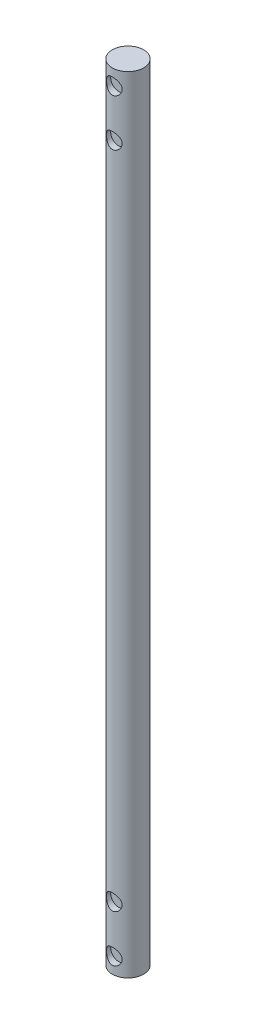
from build123d import *

# Parameters (mm, degrees)
SKETCH1_R           = 5
BOSS_EXTRUDE1_DEPTH = 250
CUT_EXTRUDE1_START  = 5
SKETCH5_R           = 2.5
CUT_EXTRUDE1_DEPTH  = 2


with BuildPart() as part:
    # Sketch1 → Boss-Extrude1 (new body)
    with BuildSketch(Plane(origin=(0, 0, 0), x_dir=(1, 0, 0), z_dir=(0, 1, 0))):
        with Locations(Location((0, 0, 0), (0, 0, 270))):
            Circle(SKETCH1_R)
    extrude(amount=BOSS_EXTRUDE1_DEPTH)

    # Sketch5 → Cut-Extrude1 (cut)
    with BuildSketch(Plane.XY.offset(CUT_EXTRUDE1_START)):
        with Locations((0, 5)):
            Circle(SKETCH5_R)
        with Locations((0, 20)):
            Circle(SKETCH5_R)
        with Locations((0, 245)):
            Circle(SKETCH5_R)
        with Locations((0, 230)):
            Circle(SKETCH5_R)
    extrude(amount=-CUT_EXTRUDE1_DEPTH, mode=Mode.SUBTRACT)


solid = part.part
